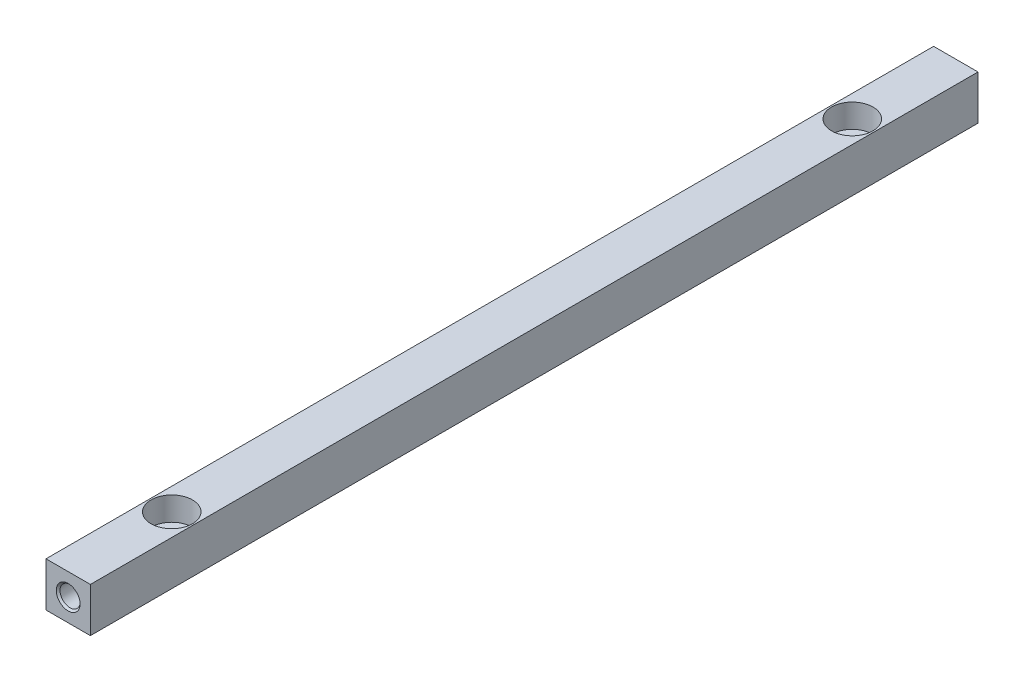
from build123d import *

# Parameters (mm, degrees)
SKETCH1_W           = 15
SKETCH1_H           = 15
BOSS_EXTRUDE1_DEPTH = 150
HOLE1_D             = 8.5
HOLE1_CBORE_D       = 14
HOLE1_CBORE_DEPTH   = 8


with BuildPart() as part:
    # Sketch1 → Boss-Extrude1 (new, symmetric)
    with BuildSketch(Plane.XY):
        Rectangle(SKETCH1_W, SKETCH1_H)
    extrude(amount=BOSS_EXTRUDE1_DEPTH, both=True)

    # Sketch3 → M8 Tapped Hole1 (revolve, cut)
    with BuildSketch(Plane(origin=(0, 0, 150), x_dir=(0, -1, 0), z_dir=(1, 0, 0))):
        Polygon((0, 0), (0, 24.292926105), (3.4, 22.25), (3.4, 0.625), (4.025, 0), align=None)
    m8_tapped_hole1 = revolve(axis=Axis((0, 0, 156.35), (0, 0, -1)), mode=Mode.SUBTRACT)

    # Mirror1: M8 Tapped Hole1 across plane
    add(m8_tapped_hole1.mirror(Plane.XY), mode=Mode.SUBTRACT)

    # Hole1 (through all)
    with Locations(Plane(origin=(0, 7.5, 0), x_dir=(1, 0, 0), z_dir=(0, 1, 0))):
        with Locations((0, 115)):
            hole1 = CounterBoreHole(HOLE1_D / 2, HOLE1_CBORE_D / 2, HOLE1_CBORE_DEPTH)

    # Mirror2: Hole1 across plane
    add(hole1.mirror(Plane.XY), mode=Mode.SUBTRACT)


solid = part.part
